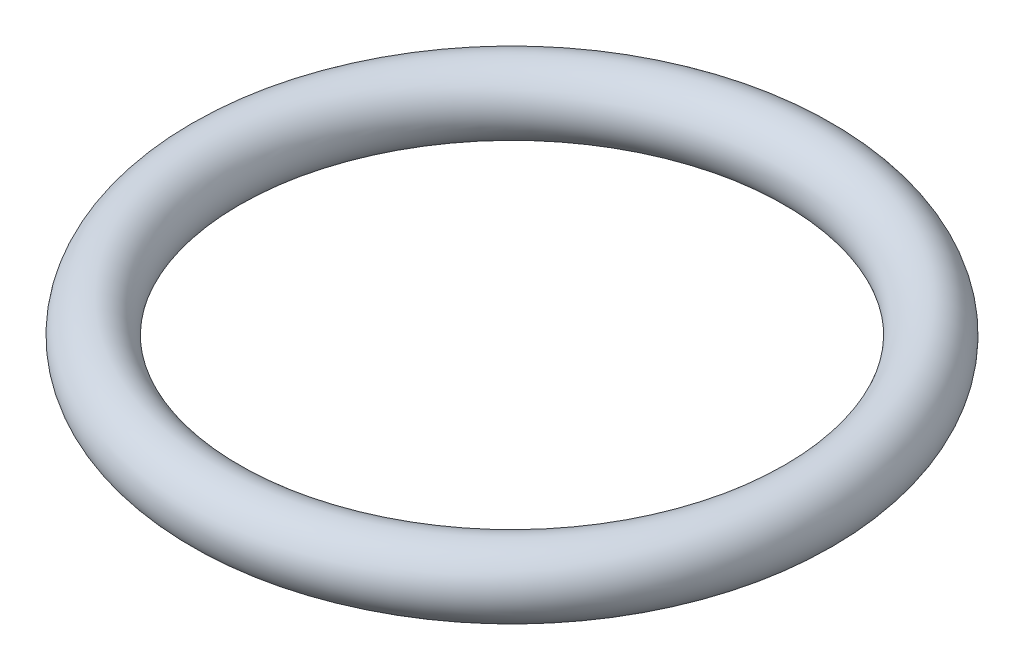
from build123d import *

# Parameters (mm, degrees)
SKETCH1_R = 0.889


with BuildPart() as part:
    # Sketch1 → Revolve1 (revolve)
    with BuildSketch(Plane.XY):
        with Locations((-7.8867, 0)):
            Circle(SKETCH1_R)
    revolve(axis=Axis((0, 22.875948006, 0), (0, -1, 0)))


solid = part.part
